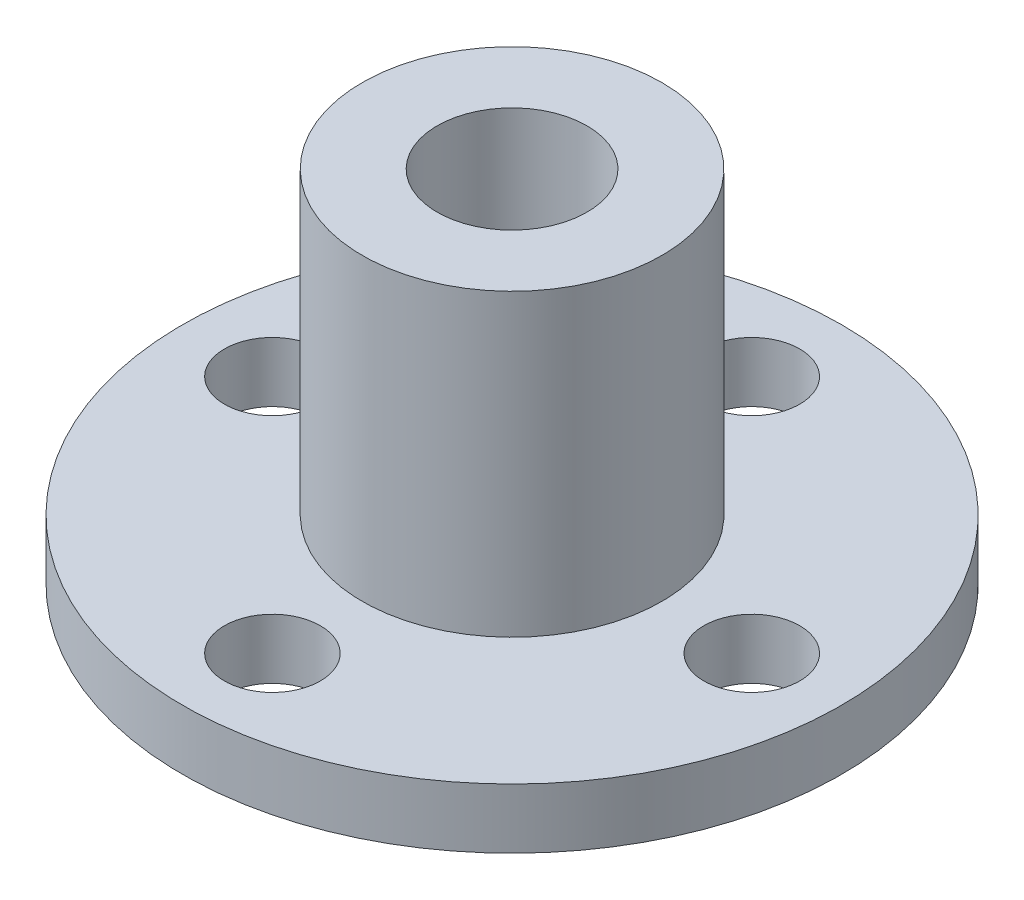
from build123d import *

# Parameters (mm, degrees)
SKETCH_2_R          = 1.6
CUT_EXTRUDE_1_DEPTH = 10


with BuildPart() as part:
    # 草图1 → 旋转1 (revolve)
    with BuildSketch(Plane.XY):
        Polygon((-2.5, 0.013967073), (-11, 0.013967073), (-11, 2.013967073), (-5, 2.013967073), (-5, 12.013967073), (-2.5, 12.013967073), align=None)
    revolve(axis=Axis((0, 0, 0), (0, 1, 0)))

    # 草图2 → 切除-拉伸1 (cut)
    with BuildSketch(Plane.XZ.offset(-0.013967073)):
        with Locations((-8, 0)):
            Circle(SKETCH_2_R)
        with Locations((0, 8)):
            Circle(SKETCH_2_R)
        with Locations((8, 0)):
            Circle(SKETCH_2_R)
        with Locations((0, -8)):
            Circle(SKETCH_2_R)
    extrude(amount=-CUT_EXTRUDE_1_DEPTH, mode=Mode.SUBTRACT)


solid = part.part
